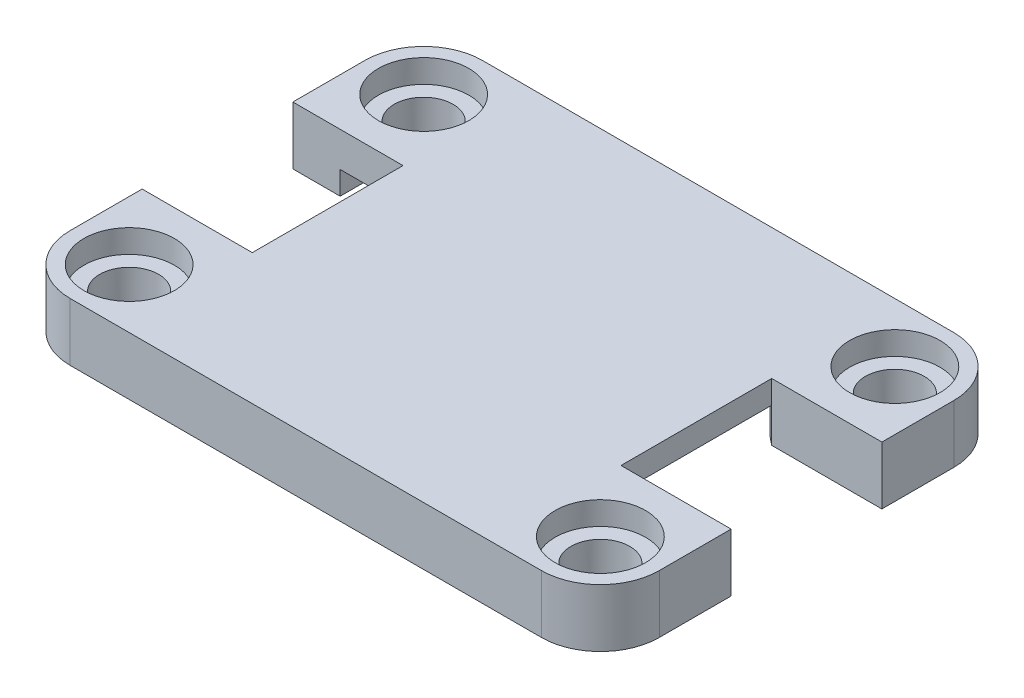
from build123d import *

# Parameters (mm, degrees)
BOSS_EXTRUDE1_DEPTH = 2.5
SKETCH3_R           = 1.27
SKETCH3_W           = 4.75
SKETCH3_H           = 6.5
CUT_EXTRUDE2_DEPTH  = 16.702614432
CUT_EXTRUDE1_START  = -2.5
CUT_EXTRUDE1_DEPTH  = 1.5
SKETCH4_R           = 1.95
CUT_EXTRUDE3_DEPTH  = 1
CUT_EXTRUDE4_START  = -2.5
SKETCH5_W           = 2.71
SKETCH5_H           = 1.15
CUT_EXTRUDE4_DEPTH  = 1


with BuildPart() as part:
    # Sketch1 → Boss-Extrude1 (new body)
    with BuildSketch(Plane(origin=(0, 0, 0), x_dir=(1, 0, 0), z_dir=(0, 1, 0))):
        with BuildLine():
            Line((-10.16, 8.89), (10.16, 8.89))
            ThreePointArc((10.16, 8.89), (11.956051224, 8.146051224), (12.7, 6.35))
            Line((12.7, 6.35), (12.7, -6.35))
            ThreePointArc((12.7, -6.35), (11.956051224, -8.146051224), (10.16, -8.89))
            Line((10.16, -8.89), (-10.16, -8.89))
            ThreePointArc((-10.16, -8.89), (-11.956051224, -8.146051224), (-12.7, -6.35))
            Line((-12.7, -6.35), (-12.7, 6.35))
            ThreePointArc((-12.7, 6.35), (-11.956051224, 8.146051224), (-10.16, 8.89))
        make_face()
    extrude(amount=BOSS_EXTRUDE1_DEPTH)

    # Sketch3 → Cut-Extrude2 (cut, through all)
    with BuildSketch(Plane(origin=(0, 2.5, 0), x_dir=(1, 0, 0), z_dir=(0, 1, 0))):
        with Locations(Location((-10.16, 6.35, 0), (0, 0, 270))):
            Circle(SKETCH3_R)
        with Locations(Location((10.16, 6.35, 0), (0, 0, 270))):
            Circle(SKETCH3_R)
        with Locations(Location((10.16, -6.35, 0), (0, 0, 270))):
            Circle(SKETCH3_R)
        with Locations(Location((-10.16, -6.35, 0), (0, 0, 270))):
            Circle(SKETCH3_R)
        with Locations((10.325, 0)):
            Rectangle(SKETCH3_W, SKETCH3_H)
        with Locations((-10.325, 0)):
            Rectangle(SKETCH3_W, SKETCH3_H)
    extrude(amount=-CUT_EXTRUDE2_DEPTH, mode=Mode.SUBTRACT)

    # Sketch2 → Cut-Extrude1 (cut)
    with BuildSketch(Plane(origin=(0, 2.5, 0), x_dir=(1, 0, 0), z_dir=(0, 1, 0)).offset(CUT_EXTRUDE1_START)):
        with BuildLine():
            Line((-3.81, -5.35), (-3.81, -3.635))
            Line((-3.81, -3.635), (3.31, -3.635))
            Line((3.31, -3.635), (3.31, -5.35))
            Line((3.31, -5.35), (6.486568362, -5.35))
            ThreePointArc((6.486568362, -5.35), (7.036509651, -4.173326382), (7.95, -3.25))
            Line((7.95, -3.25), (12.7, -3.25))
            Line((12.7, -3.25), (12.7, 3.25))
            Line((12.7, 3.25), (7.95, 3.25))
            ThreePointArc((7.95, 3.25), (7.036509651, 4.173326382), (6.486568362, 5.35))
            Line((6.486568362, 5.35), (-7.95, 5.35))
            Line((-7.95, 5.35), (-7.95, 3.25))
            Line((-7.95, 3.25), (-12.7, 3.25))
            Line((-12.7, 3.25), (-12.7, -3.25))
            Line((-12.7, -3.25), (-7.95, -3.25))
            Line((-7.95, -3.25), (-7.95, -5.35))
            Line((-7.95, -5.35), (-3.81, -5.35))
        make_face()
    extrude(amount=CUT_EXTRUDE1_DEPTH, mode=Mode.SUBTRACT)

    # Sketch4 → Cut-Extrude3 (cut)
    with BuildSketch(Plane(origin=(0, 2.5, 0), x_dir=(1, 0, 0), z_dir=(0, 1, 0))):
        with Locations(Location((-10.16, 6.35, 0), (0, 0, 270))):
            Circle(SKETCH4_R)
        with Locations(Location((10.16, 6.35, 0), (0, 0, 270))):
            Circle(SKETCH4_R)
        with Locations(Location((-10.16, -6.35, 0), (0, 0, 270))):
            Circle(SKETCH4_R)
        with Locations(Location((10.16, -6.35, 0), (0, 0, 270))):
            Circle(SKETCH4_R)
    extrude(amount=-CUT_EXTRUDE3_DEPTH, mode=Mode.SUBTRACT)

    # Sketch5 → Cut-Extrude4 (cut)
    with BuildSketch(Plane(origin=(0, 2.5, 0), x_dir=(1, 0, 0), z_dir=(0, 1, 0)).offset(CUT_EXTRUDE4_START)):
        with Locations((-9.305, 3.825)):
            Rectangle(SKETCH5_W, SKETCH5_H)
    extrude(amount=CUT_EXTRUDE4_DEPTH, mode=Mode.SUBTRACT)


solid = part.part
